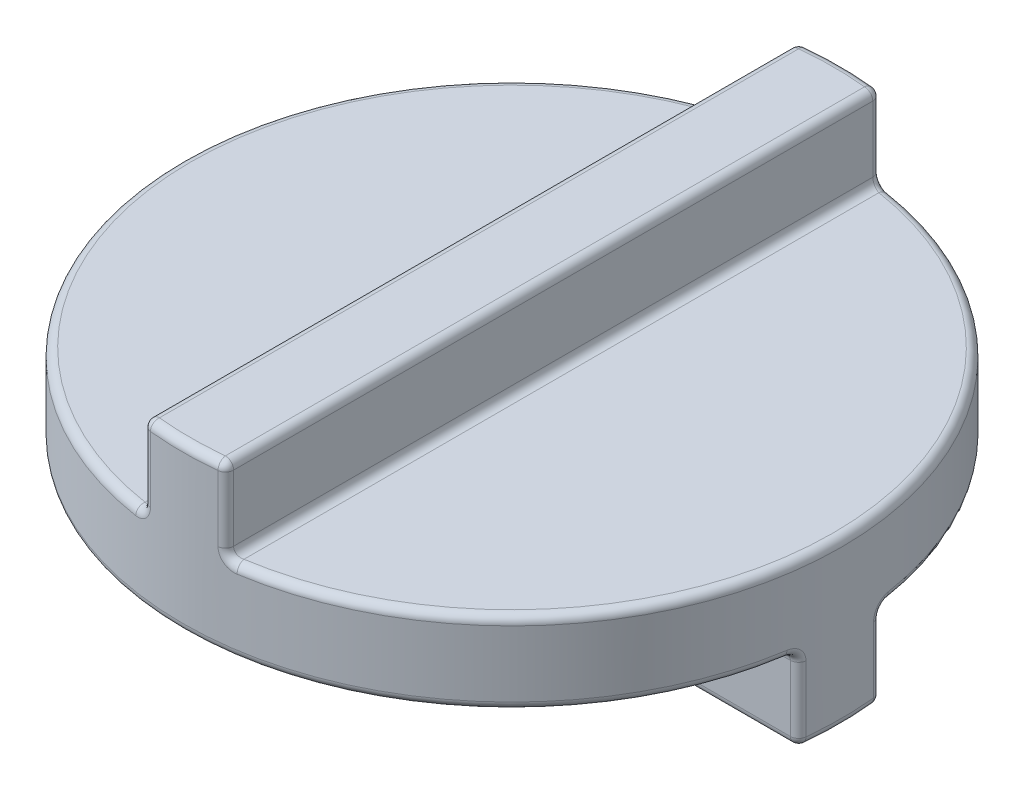
from build123d import *

# Parameters (mm, degrees)
SKETCH2_R           = 60
BOSS_EXTRUDE1_DEPTH = 22.5
SKETCH3_OUTSIDE_W   = 157.114
SKETCH3_OUTSIDE_H   = 157.114
SKETCH3_OUTSIDE_W_2 = 15
SKETCH3_OUTSIDE_H_2 = 130
CUT_EXTRUDE1_DEPTH  = 15
SKETCH4_OUTSIDE_W   = 157.114
SKETCH4_OUTSIDE_H   = 157.114
SKETCH4_OUTSIDE_W_2 = 130
SKETCH4_OUTSIDE_H_2 = 15
CUT_EXTRUDE2_DEPTH  = 15
FILLET1_R           = 1.5


with BuildPart() as part:
    # Sketch2 → Boss-Extrude1 (new, symmetric)
    with BuildSketch(Plane(origin=(0, 0, 0), x_dir=(-1, 0, 0), z_dir=(0, 1, 0))):
        with Locations(Location((0, 0, 0), (0, 0, 270))):
            Circle(SKETCH2_R)
    extrude(amount=BOSS_EXTRUDE1_DEPTH, both=True)

    # Sketch3 outside → Cut-Extrude1 (cut)
    with BuildSketch(Plane(origin=(0, 22.5, 0), x_dir=(-1, 0, 0), z_dir=(0, 1, 0))):
        Rectangle(SKETCH3_OUTSIDE_W, SKETCH3_OUTSIDE_H)
        Rectangle(SKETCH3_OUTSIDE_W_2, SKETCH3_OUTSIDE_H_2, mode=Mode.SUBTRACT)
    extrude(amount=-CUT_EXTRUDE1_DEPTH, mode=Mode.SUBTRACT)

    # Sketch4 outside → Cut-Extrude2 (cut)
    with BuildSketch(Plane.XZ.offset(22.5)):
        Rectangle(SKETCH4_OUTSIDE_W, SKETCH4_OUTSIDE_H)
        Rectangle(SKETCH4_OUTSIDE_W_2, SKETCH4_OUTSIDE_H_2, mode=Mode.SUBTRACT)
    extrude(amount=-CUT_EXTRUDE2_DEPTH, mode=Mode.SUBTRACT)

    # Fillet1
    fillet1_edges = [part.edges().sort_by_distance(p)[0] for p in [
        (7.5, 7.5, 0),
        (-7.5, 7.5, 0),
        (-7.5, 15, -59.529404499),
        (7.5, 15, 59.529404499),
        (-7.5, 15, 59.529404499),
        (7.5, 15, -59.529404499),
        (60, -22.5, 0),
        (-60, -22.5, 0),
        (0, -22.5, 7.5),
        (0, -22.5, -7.5),
        (0, -7.5, 60),
        (-39.686269666, -7.5, -45),
        (0, -7.5, 7.5),
        (0, -7.5, -7.5),
        (59.529404499, -15, -7.5),
        (-59.529404499, -15, 7.5),
        (-59.529404499, -15, -7.5),
        (59.529404499, -15, 7.5),
        (-3.757374753, 22.5, -59.882235554),
        (0, 22.5, 60),
        (7.5, 22.5, 0),
        (-7.5, 22.5, 0),
        (60, 7.5, 0),
        (-60, 7.5, 0),
    ]]
    fillet(fillet1_edges, radius=FILLET1_R)


solid = part.part
